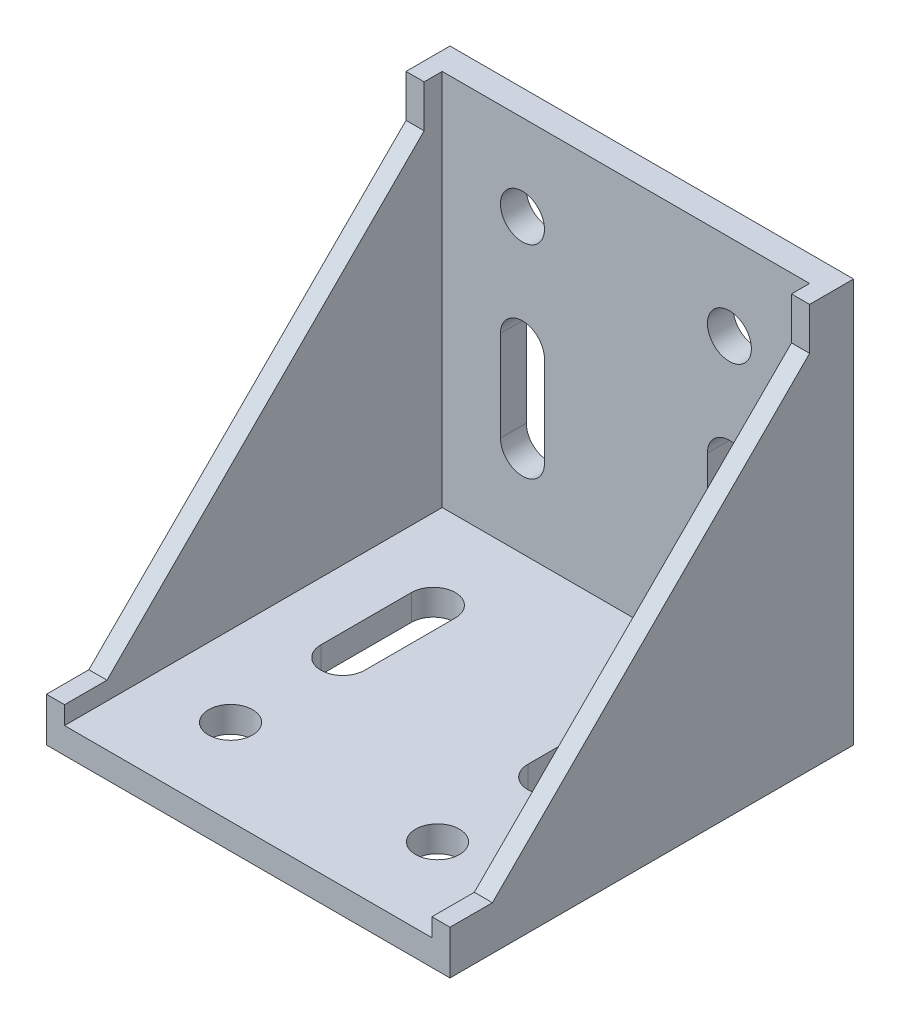
from build123d import *

# Parameters (mm, degrees)
SKETCH_3_W      = 78
SKETCH_3_H      = 78
SKETCH_3_R      = 4.25
EXTRUDE_1_DEPTH = 5
EXTRUDE_2_DEPTH = 3.5
SKETCH_5_W      = 78
SKETCH_5_H      = 78
SKETCH_5_R      = 4.25
EXTRUDE_3_DEPTH = 5


with BuildPart() as part:
    # 草图3 → 凸台-拉伸1 (new body)
    with BuildSketch(Plane.XY):
        with Locations((0, 39)):
            Rectangle(SKETCH_3_W, SKETCH_3_H)
        with Locations((-20, 61.45)):
            Circle(SKETCH_3_R, mode=Mode.SUBTRACT)
        with Locations(Location((20, 61.45, 0), (0, 0, 180))):
            Circle(SKETCH_3_R, mode=Mode.SUBTRACT)
        with BuildLine():
            Line((-15.75, 39.75), (-15.75, 22.25))
            ThreePointArc((-15.75, 22.25), (-20, 18), (-24.25, 22.25))
            Line((-24.25, 22.25), (-24.25, 39.75))
            ThreePointArc((-24.25, 39.75), (-20, 44), (-15.75, 39.75))
        make_face(mode=Mode.SUBTRACT)
        with BuildLine():
            Line((15.75, 39.75), (15.75, 22.25))
            ThreePointArc((15.75, 22.25), (20, 18), (24.25, 22.25))
            Line((24.25, 22.25), (24.25, 39.75))
            ThreePointArc((24.25, 39.75), (20, 44), (15.75, 39.75))
        make_face(mode=Mode.SUBTRACT)
    extrude(amount=EXTRUDE_1_DEPTH)

    # 草图4 → 凸台-拉伸2 (add)
    with BuildSketch(Plane.ZY.offset(39)):
        Polygon((5, 78), (8.5, 78), (8.5, 69.8), (69.8, 8.5), (78, 8.5), (78, 0), (5, 0), align=None)
    extrude_2 = extrude(amount=-EXTRUDE_2_DEPTH)

    # 镜向1: 凸台-拉伸2 across plane
    add(extrude_2.mirror(Plane(origin=(0, 0, 0), x_dir=(0, 0, 1), z_dir=(1, 0, 0))))

    # 草图5 → 凸台-拉伸3 (add)
    with BuildSketch(Plane.XZ):
        with Locations((0, 39)):
            Rectangle(SKETCH_5_W, SKETCH_5_H)
        with Locations((-20, 61.414216079)):
            Circle(SKETCH_5_R, mode=Mode.SUBTRACT)
        with Locations(Location((20, 61.414216079, 0), (0, 0, 180))):
            Circle(SKETCH_5_R, mode=Mode.SUBTRACT)
        with BuildLine():
            Line((-15.75, 39.714216079), (-15.75, 22.214216079))
            ThreePointArc((-15.75, 22.214216079), (-20, 17.964216079), (-24.25, 22.214216079))
            Line((-24.25, 22.214216079), (-24.25, 39.714216079))
            ThreePointArc((-24.25, 39.714216079), (-20, 43.964216079), (-15.75, 39.714216079))
        make_face(mode=Mode.SUBTRACT)
        with BuildLine():
            Line((15.75, 39.714216079), (15.75, 22.214216079))
            ThreePointArc((15.75, 22.214216079), (20, 17.964216079), (24.25, 22.214216079))
            Line((24.25, 22.214216079), (24.25, 39.714216079))
            ThreePointArc((24.25, 39.714216079), (20, 43.964216079), (15.75, 39.714216079))
        make_face(mode=Mode.SUBTRACT)
    extrude(amount=-EXTRUDE_3_DEPTH)


solid = part.part
